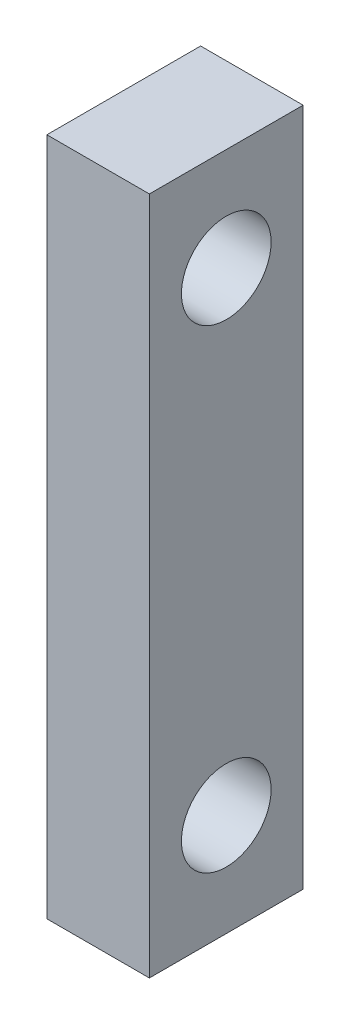
from build123d import *

# Parameters (mm, degrees)
SKETCH1_W                       = 12
SKETCH1_H                       = 53
BOSS_EXTRUDE1_DEPTH             = 8
F_6_0MM_CLEARANCE_DOWEL_HOLE1_D = 7


with BuildPart() as part:
    # Sketch1 → Boss-Extrude1 (new body)
    with BuildSketch(Plane(origin=(0, 0, 0), x_dir=(0, 0, -1), z_dir=(1, 0, 0))):
        Rectangle(SKETCH1_W, SKETCH1_H)
    extrude(amount=BOSS_EXTRUDE1_DEPTH)

    # Ø6.0mm Clearance Dowel Hole1 (through all)
    with Locations(Plane(origin=(8, 0, 0), x_dir=(0, 0, -1), z_dir=(1, 0, 0))):
        with Locations((0, 18.5), (0, -18.5)):
            Hole(F_6_0MM_CLEARANCE_DOWEL_HOLE1_D / 2)


solid = part.part
